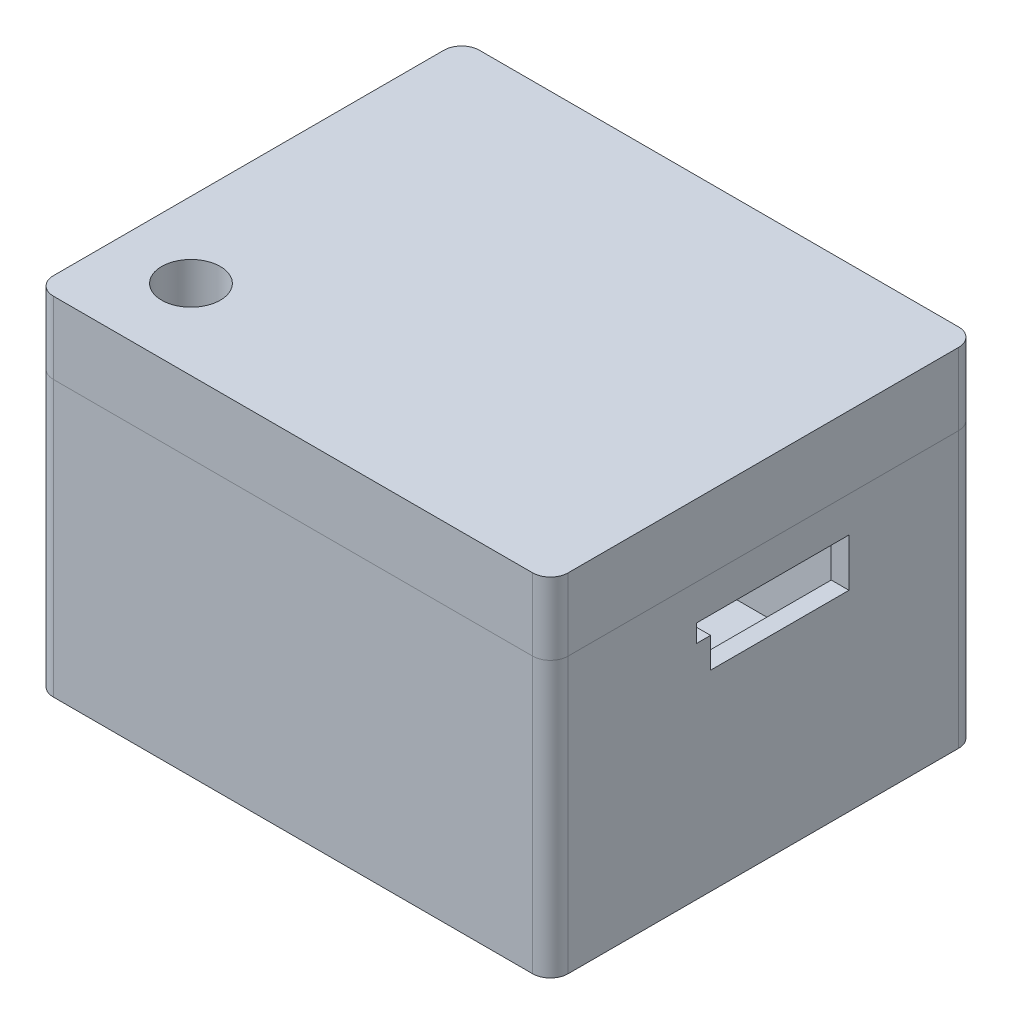
from build123d import *

# Parameters (mm, degrees)
BOSS_EXTRUDE1_DEPTH = 15.5
CUT_EXTRUDE1_DEPTH  = 14.5
CUT_EXTRUDE3_REACH  = 42.709
BOSS_EXTRUDE2_DEPTH = 4.064
CUT_EXTRUDE4_DEPTH  = 3.048
BOSS_EXTRUDE3_DEPTH = 1
SKETCH3_R           = 1.85
CUT_EXTRUDE2_DEPTH  = 1.5
CUT_EXTRUDE5_START  = 1
CUT_EXTRUDE5_DEPTH  = 0.5
BOSS_EXTRUDE4_START = 4
SKETCH6_R           = 1.4
BOSS_EXTRUDE4_DEPTH = 4
FILLET1_R           = 1
BOSS_EXTRUDE5_REACH = 42.362
SKETCH7_R           = 1.65
SKETCH8_R           = 1.65
CUT_EXTRUDE6_DEPTH  = 41.362236013
FILLET2_R           = 1
FILLET3_R           = 0.25


with BuildPart() as part:
    # Sketch1 → Boss-Extrude1 (new body)
    # profile 1 of 2: a face of its own
    with BuildSketch(Plane(origin=(0, 0, 0), x_dir=(1, 0, 0), z_dir=(0, 1, 0))):
        with BuildLine():
            ThreePointArc((1, 0), (0.292893219, 0.292893219), (0, 1))
            Line((0, 1), (0, 23))
            ThreePointArc((0, 23), (0.292893219, 23.707106781), (1, 24))
            Line((1, 24), (28, 24))
            ThreePointArc((28, 24), (28.707106781, 23.707106781), (29, 23))
            Line((29, 23), (29, 1))
            ThreePointArc((29, 1), (28.707106781, 0.292893219), (28, 0))
            Line((28, 0), (1, 0))
        make_face()
        with BuildLine():
            ThreePointArc((1, 2), (1.292893219, 1.292893219), (2, 1))
            Line((2, 1), (27, 1))
            ThreePointArc((27, 1), (27.707106781, 1.292893219), (28, 2))
            Line((28, 2), (28, 22))
            ThreePointArc((28, 22), (27.707106781, 22.707106781), (27, 23))
            Line((27, 23), (2, 23))
            ThreePointArc((2, 23), (1.292893219, 22.707106781), (1, 22))
            Line((1, 22), (1, 2))
        make_face(mode=Mode.SUBTRACT)
    # profile 2 of 2: a face of its own
    with BuildSketch(Plane(origin=(0, 0, 0), x_dir=(1, 0, 0), z_dir=(0, 1, 0))):
        with BuildLine():
            Line((1, 2), (1, 22))
            ThreePointArc((1, 22), (1.292893219, 22.707106781), (2, 23))
            Line((2, 23), (27, 23))
            ThreePointArc((27, 23), (27.707106781, 22.707106781), (28, 22))
            Line((28, 22), (28, 2))
            ThreePointArc((28, 2), (27.707106781, 1.292893219), (27, 1))
            Line((27, 1), (2, 1))
            ThreePointArc((2, 1), (1.292893219, 1.292893219), (1, 2))
        make_face()
    extrude(amount=BOSS_EXTRUDE1_DEPTH)

    # Sketch2 → Cut-Extrude1 (cut)
    with BuildSketch(Plane(origin=(0, 15.5, 0), x_dir=(1, 0, 0), z_dir=(0, 1, 0))):
        with BuildLine():
            Line((1, 2), (1, 22))
            ThreePointArc((1, 22), (1.292893219, 22.707106781), (2, 23))
            Line((2, 23), (27, 23))
            ThreePointArc((27, 23), (27.707106781, 22.707106781), (28, 22))
            Line((28, 22), (28, 2))
            ThreePointArc((28, 2), (27.707106781, 1.292893219), (27, 1))
            Line((27, 1), (2, 1))
            ThreePointArc((2, 1), (1.292893219, 1.292893219), (1, 2))
        make_face()
    extrude(amount=-CUT_EXTRUDE1_DEPTH, mode=Mode.SUBTRACT)

    # Sketch4 → Cut-Extrude3 (cut, up to next)
    with BuildSketch(Plane(origin=(29, 0, 0), x_dir=(0, 0, -1), z_dir=(1, 0, 0)), mode=Mode.PRIVATE) as cut_extrude3_sk1:
        Polygon((8.225, 13.5), (16.825, 13.5), (16.825, 10.8), (9.025, 10.8), (9.025, 12.5), (8.225, 12.5), align=None)
    cut_extrude3_tool1 = extrude(cut_extrude3_sk1.sketch, amount=-CUT_EXTRUDE3_REACH, mode=Mode.PRIVATE) & part.part
    add(cut_extrude3_tool1.solids().sort_by_distance((29, 12.181107, -12.767635))[0], mode=Mode.SUBTRACT)


with BuildPart() as body_2:
    # Sketch5 → Boss-Extrude2 (new body)
    # profile 1 of 4: a face of its own
    with BuildSketch(Plane(origin=(0, 15.5, 0), x_dir=(1, 0, 0), z_dir=(0, 1, 0))):
        with BuildLine():
            Line((0, 23), (0, 1))
            ThreePointArc((0, 1), (0.292893219, 0.292893219), (1, 0))
            Line((1, 0), (28, 0))
            ThreePointArc((28, 0), (28.707106781, 0.292893219), (29, 1))
            Line((29, 1), (29, 23))
            ThreePointArc((29, 23), (28.707106781, 23.707106781), (28, 24))
            Line((28, 24), (1, 24))
            ThreePointArc((1, 24), (0.292893219, 23.707106781), (0, 23))
        make_face()
        with BuildLine():
            Line((27, 1), (2, 1))
            ThreePointArc((2, 1), (1.292893219, 1.292893219), (1, 2))
            Line((1, 2), (1, 22))
            ThreePointArc((1, 22), (1.292893219, 22.707106781), (2, 23))
            Line((2, 23), (27, 23))
            ThreePointArc((27, 23), (27.707106781, 22.707106781), (28, 22))
            Line((28, 22), (28, 2))
            ThreePointArc((28, 2), (27.707106781, 1.292893219), (27, 1))
        make_face(mode=Mode.SUBTRACT)
    # profile 2 of 4: a face of its own
    with BuildSketch(Plane(origin=(0, 15.5, 0), x_dir=(1, 0, 0), z_dir=(0, 1, 0))):
        with BuildLine():
            ThreePointArc((2, 1), (1.292893219, 1.292893219), (1, 2))
            Line((1, 2), (1, 22))
            ThreePointArc((1, 22), (1.292893219, 22.707106781), (2, 23))
            Line((2, 23), (27, 23))
            ThreePointArc((27, 23), (27.707106781, 22.707106781), (28, 22))
            Line((28, 22), (28, 2))
            ThreePointArc((28, 2), (27.707106781, 1.292893219), (27, 1))
            Line((27, 1), (2, 1))
        make_face()
        with BuildLine():
            ThreePointArc((2, 22.5), (1.646446609, 22.353553391), (1.5, 22))
            Line((1.5, 22), (1.5, 2))
            ThreePointArc((1.5, 2), (1.646446609, 1.646446609), (2, 1.5))
            Line((2, 1.5), (27, 1.5))
            ThreePointArc((27, 1.5), (27.353553391, 1.646446609), (27.5, 2))
            Line((27.5, 2), (27.5, 22))
            ThreePointArc((27.5, 22), (27.353553391, 22.353553391), (27, 22.5))
            Line((27, 22.5), (2, 22.5))
        make_face(mode=Mode.SUBTRACT)
    # profile 3 of 4: a face of its own
    with BuildSketch(Plane(origin=(0, 15.5, 0), x_dir=(1, 0, 0), z_dir=(0, 1, 0))):
        with BuildLine():
            Line((27, 22.5), (2, 22.5))
            ThreePointArc((2, 22.5), (1.646446609, 22.353553391), (1.5, 22))
            Line((1.5, 22), (1.5, 2))
            ThreePointArc((1.5, 2), (1.646446609, 1.646446609), (2, 1.5))
            Line((2, 1.5), (27, 1.5))
            ThreePointArc((27, 1.5), (27.353553391, 1.646446609), (27.5, 2))
            Line((27.5, 2), (27.5, 22))
            ThreePointArc((27.5, 22), (27.353553391, 22.353553391), (27, 22.5))
        make_face()
    # profile 4 of 4: a face of its own
    with BuildSketch(Plane(origin=(0, 15.5, 0), x_dir=(1, 0, 0), z_dir=(0, 1, 0))):
        with BuildLine():
            Line((1, 22), (1, 2))
            ThreePointArc((1, 2), (1.292893219, 1.292893219), (2, 1))
            Line((2, 1), (27, 1))
            ThreePointArc((27, 1), (27.707106781, 1.292893219), (28, 2))
            Line((28, 2), (28, 22))
            ThreePointArc((28, 22), (27.707106781, 22.707106781), (27, 23))
            Line((27, 23), (2, 23))
            ThreePointArc((2, 23), (1.292893219, 22.707106781), (1, 22))
        make_face()
    extrude(amount=BOSS_EXTRUDE2_DEPTH)

    # Sketch5<3> → Cut-Extrude4 (cut)
    with BuildSketch(Plane(origin=(0, 15.5, 0), x_dir=(1, 0, 0), z_dir=(0, 1, 0))):
        with BuildLine():
            Line((27, 22.5), (2, 22.5))
            ThreePointArc((2, 22.5), (1.646446609, 22.353553391), (1.5, 22))
            Line((1.5, 22), (1.5, 2))
            ThreePointArc((1.5, 2), (1.646446609, 1.646446609), (2, 1.5))
            Line((2, 1.5), (27, 1.5))
            ThreePointArc((27, 1.5), (27.353553391, 1.646446609), (27.5, 2))
            Line((27.5, 2), (27.5, 22))
            ThreePointArc((27.5, 22), (27.353553391, 22.353553391), (27, 22.5))
        make_face()
    extrude(amount=CUT_EXTRUDE4_DEPTH, mode=Mode.SUBTRACT)

    # Sketch5<4> → Boss-Extrude3 (add)
    with BuildSketch(Plane(origin=(0, 15.5, 0), x_dir=(1, 0, 0), z_dir=(0, 1, 0))):
        with BuildLine():
            ThreePointArc((2, 1), (1.292893219, 1.292893219), (1, 2))
            Line((1, 2), (1, 22))
            ThreePointArc((1, 22), (1.292893219, 22.707106781), (2, 23))
            Line((2, 23), (27, 23))
            ThreePointArc((27, 23), (27.707106781, 22.707106781), (28, 22))
            Line((28, 22), (28, 2))
            ThreePointArc((28, 2), (27.707106781, 1.292893219), (27, 1))
            Line((27, 1), (2, 1))
        make_face()
        with BuildLine():
            ThreePointArc((2, 22.5), (1.646446609, 22.353553391), (1.5, 22))
            Line((1.5, 22), (1.5, 2))
            ThreePointArc((1.5, 2), (1.646446609, 1.646446609), (2, 1.5))
            Line((2, 1.5), (27, 1.5))
            ThreePointArc((27, 1.5), (27.353553391, 1.646446609), (27.5, 2))
            Line((27.5, 2), (27.5, 22))
            ThreePointArc((27.5, 22), (27.353553391, 22.353553391), (27, 22.5))
            Line((27, 22.5), (2, 22.5))
        make_face(mode=Mode.SUBTRACT)
    extrude(amount=-BOSS_EXTRUDE3_DEPTH)


with BuildPart() as cut_extrude2_tool:
    # Sketch3 → Cut-Extrude2 (new body)
    with BuildSketch(Plane(origin=(0, 0, 0), x_dir=(0, 0, -1), z_dir=(1, 0, 0))):
        with Locations((15.159, 15.5)):
            Circle(SKETCH3_R)
        with Locations(Location((10.841, 8.388, 0), (0, 0, 180))):
            Circle(SKETCH3_R)
    extrude(amount=CUT_EXTRUDE2_DEPTH)


with BuildPart() as part_1:
    add(part.part)

    # Cut-Extrude2: cut by cut_extrude2_tool
    add(cut_extrude2_tool.part, mode=Mode.SUBTRACT)

    # Sketch6 → Boss-Extrude4 (add)
    with BuildSketch(Plane(origin=(0, 1, 0), x_dir=(1, 0, 0), z_dir=(0, 1, 0)).offset(BOSS_EXTRUDE4_START)):
        with BuildLine():
            Line((1, 8), (7.5, 8))
            Line((7.5, 8), (7.5, 1))
            Line((7.5, 1), (2, 1))
            ThreePointArc((2, 1), (1.292893219, 1.292893219), (1, 2))
            Line((1, 2), (1, 8))
        make_face()
        with Locations(Location((4.25, 4.5, 0), (0, 0, 270))):
            Circle(SKETCH6_R, mode=Mode.SUBTRACT)
    extrude(amount=-BOSS_EXTRUDE4_DEPTH)

    # Fillet1
    fillet1_edges = [part_1.edges().sort_by_distance(p)[0] for p in [
        (7.5, 3, -1),
        (7.5, 3, -8),
        (1, 3, -8),
    ]]
    fillet(fillet1_edges, radius=FILLET1_R)


with BuildPart() as body_2_1:
    add(body_2.part)

    # Cut-Extrude2: cut by cut_extrude2_tool
    add(cut_extrude2_tool.part, mode=Mode.SUBTRACT)

    # Sketch3<3> → Cut-Extrude5 (cut)
    with BuildSketch(Plane(origin=(0, 0, 0), x_dir=(0, 0, -1), z_dir=(1, 0, 0)).offset(CUT_EXTRUDE5_START)):
        with BuildLine():
            Line((17.009, 13.65), (17.009, 15.5))
            ThreePointArc((17.009, 15.5), (16.467147545, 14.191852455), (15.159, 13.65))
            Line((15.159, 13.65), (17.009, 13.65))
        make_face()
        with BuildLine():
            ThreePointArc((15.159, 13.65), (13.850852455, 14.191852455), (13.309, 15.5))
            Line((13.309, 15.5), (13.309, 13.65))
            Line((13.309, 13.65), (15.159, 13.65))
        make_face()
    extrude(amount=CUT_EXTRUDE5_DEPTH, mode=Mode.SUBTRACT)

    # Sketch7 → Boss-Extrude5 (add, up to next)
    with BuildSketch(Plane(origin=(0, 5, 0), x_dir=(1, 0, 0), z_dir=(0, 1, 0)), mode=Mode.PRIVATE) as boss_extrude5_sk1:
        with BuildLine():
            Line((7.5, 8), (1, 8))
            Line((1, 8), (1, 2))
            ThreePointArc((1, 2), (1.292893219, 1.292893219), (2, 1))
            Line((2, 1), (7.5, 1))
            Line((7.5, 1), (7.5, 8))
        make_face()
        with Locations(Location((4.25, 4.5, 0), (0, 0, 270))):
            Circle(SKETCH7_R, mode=Mode.SUBTRACT)
    boss_extrude5_tool1 = extrude(boss_extrude5_sk1.sketch, amount=BOSS_EXTRUDE5_REACH, mode=Mode.PRIVATE) - body_2_1.part
    add(boss_extrude5_tool1.solids().sort_by_distance((4.25, 5, -7.904475))[0])

    # Sketch8 → Cut-Extrude6 (cut, through all)
    with BuildSketch(Plane.XZ.offset(-5)):
        with Locations(Location((4.25, -4.5, 0), (0, 0, 270))):
            Circle(SKETCH8_R)
    extrude(amount=-CUT_EXTRUDE6_DEPTH, mode=Mode.SUBTRACT)

    # Fillet2
    fillet2_edges = [body_2_1.edges().sort_by_distance(p)[0] for p in [
        (7.5, 16.524, -1.5),
        (7.5, 11.774, -8),
        (1.5, 16.524, -8),
    ]]
    fillet(fillet2_edges, radius=FILLET2_R)

    # Fillet3
    fillet3_edges = [body_2_1.edges().sort_by_distance(p)[0] for p in [
        (1, 9.75, -8),
        (7.5, 9.75, -1),
    ]]
    fillet(fillet3_edges, radius=FILLET3_R)


solid = Compound([part_1.part, body_2_1.part])
